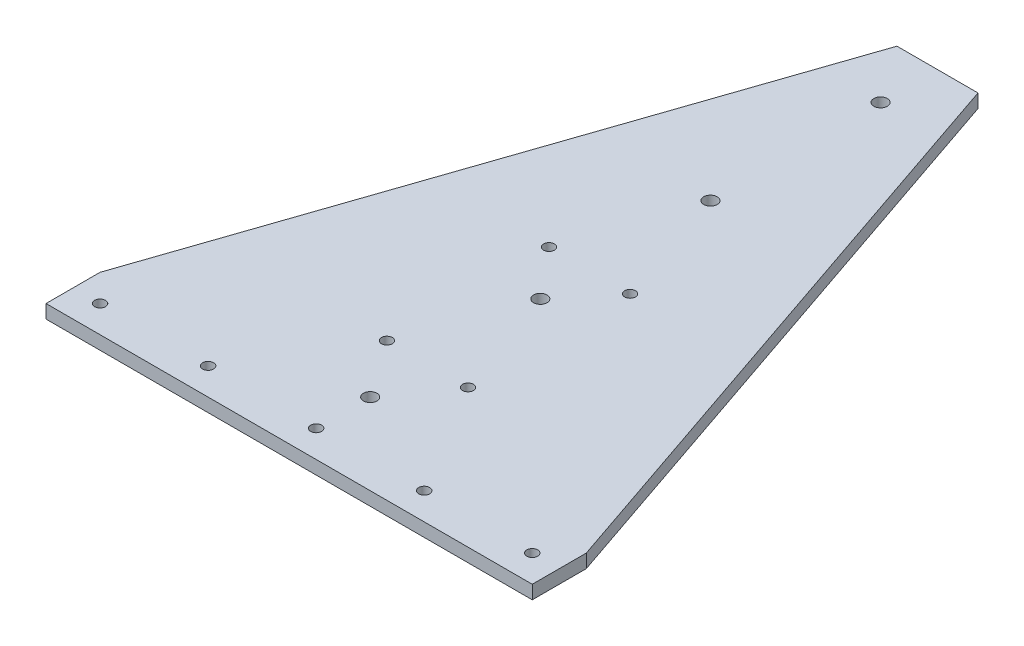
from build123d import *

# Parameters (mm, degrees)
BOSS_EXTRUDE1_DEPTH         = 6.35
SKETCH2_R                   = 2.5796875
SKETCH2_R_2                 = 3.175
CUT_EXTRUDE1_DEPTH          = 382.052912992
SKETCH3_R                   = 1.905
CUT_EXTRUDE2_DEPTH          = 382.052912992
F_1_4_20_TAPPED_HOLE1_D     = 5.1054
F_1_4_20_TAPPED_HOLE1_DEPTH = 16.51
F_1_4_20_TAPPED_HOLE1_TIP   = 1.533816902


with BuildPart() as part:
    # Sketch1 → Boss-Extrude1 (new body)
    with BuildSketch(Plane(origin=(0, 0, 0), x_dir=(1, 0, 0), z_dir=(0, 1, 0))):
        Polygon((0, 0), (228.6, 0), (228.6, 25.4), (133.35, 304.8), (95.25, 304.8), (0, 25.4), align=None)
    extrude(amount=BOSS_EXTRUDE1_DEPTH)

    # Sketch2 → Cut-Extrude1 (cut, through all)
    with BuildSketch(Plane(origin=(0, 6.35, 0), x_dir=(1, 0, 0), z_dir=(0, 1, 0))):
        with Locations(Location((165.1, 12.7, 0), (0, 0, 270))):
            Circle(SKETCH2_R)
        with Locations(Location((114.3, 12.7, 0), (0, 0, 270))):
            Circle(SKETCH2_R)
        with Locations(Location((63.5, 12.7, 0), (0, 0, 270))):
            Circle(SKETCH2_R)
        with Locations(Location((114.3, 38.1, 0), (0, 0, 270))):
            Circle(SKETCH2_R_2)
        with Locations(Location((114.3, 118.0846, 0), (0, 0, 270))):
            Circle(SKETCH2_R_2)
        with Locations(Location((114.3, 198.0692, 0), (0, 0, 270))):
            Circle(SKETCH2_R_2)
        with Locations(Location((114.3, 278.0538, 0), (0, 0, 270))):
            Circle(SKETCH2_R_2)
        with Locations(Location((12.7, 12.7, 0), (0, 0, 270))):
            Circle(SKETCH2_R)
        with Locations(Location((215.9, 12.7, 0), (0, 0, 270))):
            Circle(SKETCH2_R)
    extrude(amount=-CUT_EXTRUDE1_DEPTH, mode=Mode.SUBTRACT)

    # Sketch3 → Cut-Extrude2 (cut, through all)
    with BuildSketch(Plane(origin=(0, 6.35, 0), x_dir=(1, 0, 0), z_dir=(0, 1, 0))):
        with Locations(Location((133.35, 65.024, 0), (0, 0, 270))):
            Circle(SKETCH3_R)
        with Locations(Location((95.25, 65.024, 0), (0, 0, 270))):
            Circle(SKETCH3_R)
        with Locations(Location((133.35, 141.224, 0), (0, 0, 270))):
            Circle(SKETCH3_R)
        with Locations(Location((95.25, 141.224, 0), (0, 0, 270))):
            Circle(SKETCH3_R)
    extrude(amount=-CUT_EXTRUDE2_DEPTH, mode=Mode.SUBTRACT)

    # 1/4-20 Tapped Hole1
    with Locations(Plane(origin=(0, 6.35, 0), x_dir=(1, 0, 0), z_dir=(0, 1, 0))):
        with Locations((95.25, 141.224), (133.35, 141.224), (133.35, 65.024), (95.25, 65.024)):
            Hole(F_1_4_20_TAPPED_HOLE1_D / 2, depth=F_1_4_20_TAPPED_HOLE1_DEPTH)
            with Locations((0, 0, -(F_1_4_20_TAPPED_HOLE1_DEPTH + F_1_4_20_TAPPED_HOLE1_TIP / 2))):  # 118° drill point
                Cone(0, F_1_4_20_TAPPED_HOLE1_D / 2, F_1_4_20_TAPPED_HOLE1_TIP, mode=Mode.SUBTRACT)


solid = part.part
